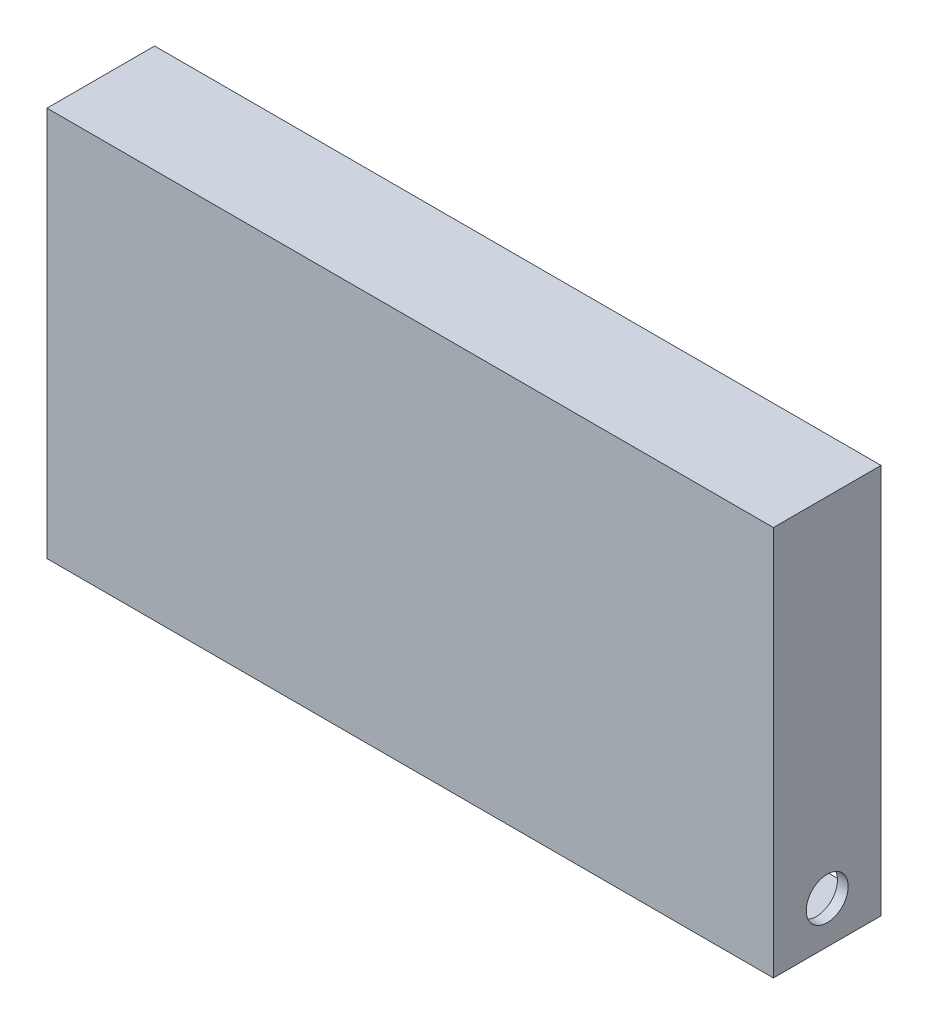
from build123d import *

# Parameters (mm, degrees)
SKETCH3_W            = 135
SKETCH3_H            = 72.5
BOSS_EXTRUDE1_DEPTH  = 20
SKETCH4_W            = 131
SKETCH4_H            = 68.5
CUT_EXTRUDE1_DEPTH   = 18
SKETCH6_W            = 23
SKETCH6_H            = 45.9
BOSS_EXTRUDE2_DEPTH  = 8
SKETCH5_W            = 21.8
SKETCH5_H            = 43.5
CUT_EXTRUDE2_DEPTH   = 18
SKETCH7_W            = 1.2
SKETCH7_H            = 8.3
SKETCH7_H_2          = 11.3
BOSS_EXTRUDE5_DEPTH  = 8
SKETCH9_W            = 1.2
SKETCH9_H            = 65.5
BOSS_EXTRUDE6_DEPTH  = 8
SKETCH11_W           = 26.8
SKETCH11_H           = 36
BOSS_EXTRUDE7_DEPTH  = 8
SKETCH10_W           = 25.6
SKETCH10_H           = 33.6
CUT_EXTRUDE3_DEPTH   = 8
SKETCH13_W           = 8
SKETCH13_H           = 33.6
CUT_EXTRUDE4_DEPTH   = 1.2
SKETCH14_R           = 3.9
CUT_EXTRUDE5_DEPTH   = 2
SKETCH15_R           = 5.9
CUT_EXTRUDE6_DEPTH   = 2
SKETCH18_W           = 5
SKETCH18_H           = 5
BOSS_EXTRUDE8_DEPTH  = 5
SKETCH19_R           = 1.5
CUT_EXTRUDE7_DEPTH   = 8
SKETCH20_W           = 5
SKETCH20_H           = 5
BOSS_EXTRUDE9_DEPTH  = 5
SKETCH21_R           = 1.5
CUT_EXTRUDE8_DEPTH   = 5
SKETCH23_W           = 7
SKETCH23_H           = 7
BOSS_EXTRUDE10_DEPTH = 5
SKETCH24_R           = 1.5
CUT_EXTRUDE10_DEPTH  = 5


with BuildPart() as part:
    # Sketch3 → Boss-Extrude1 (new body)
    with BuildSketch(Plane.XY):
        Rectangle(SKETCH3_W, SKETCH3_H)
    extrude(amount=BOSS_EXTRUDE1_DEPTH)

    # Sketch4 → Cut-Extrude1 (cut)
    with BuildSketch(Plane(origin=(0, 0, 0), x_dir=(-1, 0, 0), z_dir=(0, 0, -1))):
        Rectangle(SKETCH4_W, SKETCH4_H)
    extrude(amount=-CUT_EXTRUDE1_DEPTH, mode=Mode.SUBTRACT)

    # Sketch6 → Boss-Extrude2 (add)
    with BuildSketch(Plane(origin=(0, 0, 18), x_dir=(-1, 0, 0), z_dir=(0, 0, -1))):
        with Locations((-54, 0)):
            Rectangle(SKETCH6_W, SKETCH6_H)
    extrude(amount=BOSS_EXTRUDE2_DEPTH)

    # Sketch5 → Cut-Extrude2 (cut)
    with BuildSketch(Plane(origin=(0, 0, 18), x_dir=(-1, 0, 0), z_dir=(0, 0, -1))):
        with Locations((-54.6, 0)):
            Rectangle(SKETCH5_W, SKETCH5_H)
    extrude(amount=CUT_EXTRUDE2_DEPTH, mode=Mode.SUBTRACT)

    # Sketch7 → Boss-Extrude5 (add)
    with BuildSketch(Plane(origin=(0, 0, 18), x_dir=(-1, 0, 0), z_dir=(0, 0, -1))):
        with Locations((-43.1, -27.1)):
            Rectangle(SKETCH7_W, SKETCH7_H)
        with Locations((-43.1, 28.6)):
            Rectangle(SKETCH7_W, SKETCH7_H_2)
    extrude(amount=BOSS_EXTRUDE5_DEPTH)

    # Sketch9 → Boss-Extrude6 (add)
    with BuildSketch(Plane(origin=(0, 0, 18), x_dir=(-1, 0, 0), z_dir=(0, 0, -1))):
        with Locations((25.55, 1.5)):
            Rectangle(SKETCH9_W, SKETCH9_H)
    extrude(amount=BOSS_EXTRUDE6_DEPTH)

    # Sketch11 → Boss-Extrude7 (add)
    with BuildSketch(Plane(origin=(0, 0, 18), x_dir=(-1, 0, 0), z_dir=(0, 0, -1))):
        with Locations((39.55, 0)):
            Rectangle(SKETCH11_W, SKETCH11_H)
    extrude(amount=BOSS_EXTRUDE7_DEPTH)

    # Sketch10 → Cut-Extrude3 (cut)
    with BuildSketch(Plane(origin=(0, 0, 18), x_dir=(-1, 0, 0), z_dir=(0, 0, -1))):
        with Locations((38.95, 0)):
            Rectangle(SKETCH10_W, SKETCH10_H)
    extrude(amount=CUT_EXTRUDE3_DEPTH, mode=Mode.SUBTRACT)

    # Sketch13 → Cut-Extrude4 (cut)
    with BuildSketch(Plane.ZY.offset(52.95)):
        with Locations((14, 0)):
            Rectangle(SKETCH13_W, SKETCH13_H)
    extrude(amount=-CUT_EXTRUDE4_DEPTH, mode=Mode.SUBTRACT)

    # Sketch14 → Cut-Extrude5 (cut)
    with BuildSketch(Plane(origin=(67.5, 0, 0), x_dir=(0, 0, -1), z_dir=(1, 0, 0))):
        with Locations((-10, -28.45)):
            Circle(SKETCH14_R)
    extrude(amount=-CUT_EXTRUDE5_DEPTH, mode=Mode.SUBTRACT)

    # Sketch15 → Cut-Extrude6 (cut)
    with BuildSketch(Plane.ZY.offset(67.5)):
        with Locations((10, 26.25)):
            Circle(SKETCH15_R)
        with Locations((10, 6.25)):
            Circle(SKETCH15_R)
        with Locations((10, -13.75)):
            Circle(SKETCH15_R)
    extrude(amount=-CUT_EXTRUDE6_DEPTH, mode=Mode.SUBTRACT)

    # Sketch18 → Boss-Extrude8 (add)
    with BuildSketch(Plane(origin=(0, 0, 18), x_dir=(-1, 0, 0), z_dir=(0, 0, -1))):
        with Locations((39.55, -14.3)):
            Rectangle(SKETCH18_W, SKETCH18_H)
        with Locations((39.55, 14.3)):
            Rectangle(SKETCH18_W, SKETCH18_H)
    extrude(amount=BOSS_EXTRUDE8_DEPTH)

    # Sketch19 → Cut-Extrude7 (cut)
    with BuildSketch(Plane(origin=(0, 0, 10), x_dir=(-1, 0, 0), z_dir=(0, 0, -1))):
        with Locations((39.663798911, -14.3)):
            Circle(SKETCH19_R)
        with Locations((39.663798911, 14.3)):
            Circle(SKETCH19_R)
    extrude(amount=-CUT_EXTRUDE7_DEPTH, mode=Mode.SUBTRACT)

    # Sketch20 → Boss-Extrude9 (add)
    with BuildSketch(Plane(origin=(0, 0, 18), x_dir=(-1, 0, 0), z_dir=(0, 0, -1))):
        with Locations((-46.2, 16.25)):
            Rectangle(SKETCH20_W, SKETCH20_H)
        with Locations((-63, -16.25)):
            Rectangle(SKETCH20_W, SKETCH20_H)
    extrude(amount=BOSS_EXTRUDE9_DEPTH)

    # Sketch21 → Cut-Extrude8 (cut)
    with BuildSketch(Plane(origin=(0, 0, 13), x_dir=(-1, 0, 0), z_dir=(0, 0, -1))):
        with Locations((-46.2, 16.25)):
            Circle(SKETCH21_R)
        with Locations((-63, -16.25)):
            Circle(SKETCH21_R)
    extrude(amount=-CUT_EXTRUDE8_DEPTH, mode=Mode.SUBTRACT)

    # Sketch23 → Boss-Extrude10 (add)
    with BuildSketch(Plane(origin=(0, 0, 18), x_dir=(-1, 0, 0), z_dir=(0, 0, -1))):
        with Locations((-39, 30.75)):
            Rectangle(SKETCH23_W, SKETCH23_H)
        with Locations((21.45, 30.75)):
            Rectangle(SKETCH23_W, SKETCH23_H)
        with Locations((21.45, -27.75)):
            Rectangle(SKETCH23_W, SKETCH23_H)
        with Locations((-39, -27.75)):
            Rectangle(SKETCH23_W, SKETCH23_H)
    extrude(amount=BOSS_EXTRUDE10_DEPTH)

    # Sketch24 → Cut-Extrude10 (cut)
    with BuildSketch(Plane(origin=(0, 0, 13), x_dir=(-1, 0, 0), z_dir=(0, 0, -1))):
        with Locations((-39, 30.75)):
            Circle(SKETCH24_R)
        with Locations((21.45, 30.75)):
            Circle(SKETCH24_R)
        with Locations((21.45, -27.75)):
            Circle(SKETCH24_R)
        with Locations((-39, -27.75)):
            Circle(SKETCH24_R)
    extrude(amount=-CUT_EXTRUDE10_DEPTH, mode=Mode.SUBTRACT)


solid = part.part
